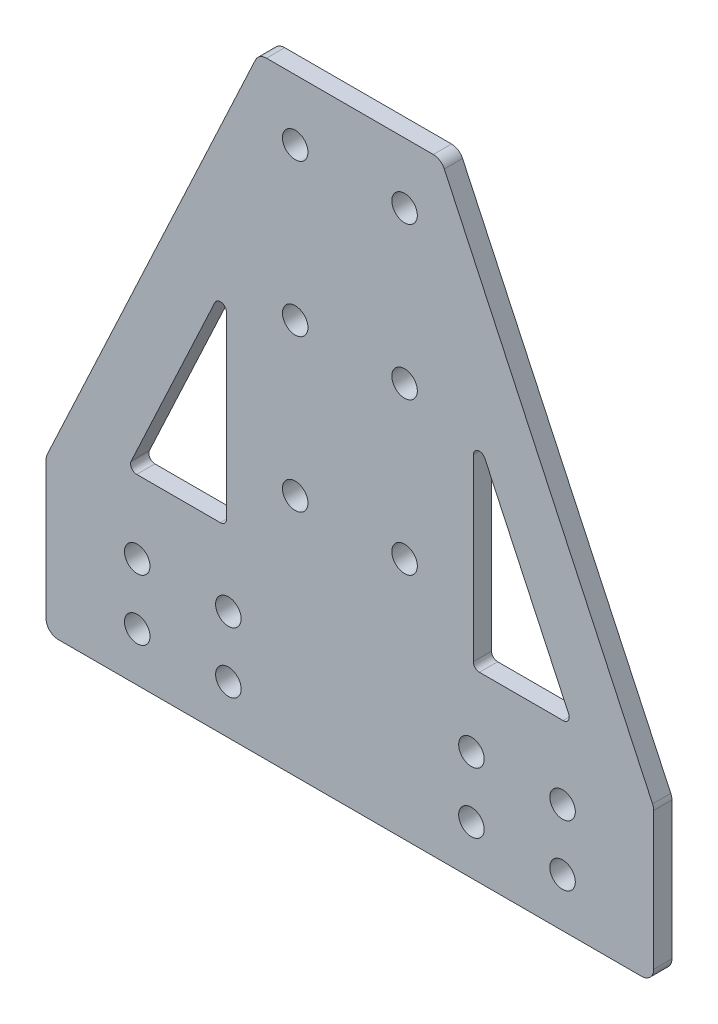
from build123d import *

# Parameters (mm, degrees)
EXTRUDE_1_DEPTH     = 3
CUT_EXTRUDE_2_REACH = 76.221
SKETCH_2_R          = 2.1
FILLET_1_R          = 2


with BuildPart() as part:
    # 草图1 → 凸台-拉伸1 (new body)
    with BuildSketch(Plane.XY):
        Polygon((-15, 45.229945154), (15, 45.229945154), (50, -29.684017461), (50, -54.770054846), (-50, -54.770054846), (-50, -29.684017461), align=None)
    extrude(amount=EXTRUDE_1_DEPTH)

    # 草图2 → 切除-拉伸2 (cut, up to next)
    with BuildSketch(Plane.XY.offset(3), mode=Mode.PRIVATE) as cut_extrude_2_sk1:
        with Locations((-9, 35.229945154)):
            Circle(SKETCH_2_R)
    cut_extrude_2_tool1 = extrude(cut_extrude_2_sk1.sketch, amount=-CUT_EXTRUDE_2_REACH, mode=Mode.PRIVATE) & part.part
    # 草图2 → 切除-拉伸2 (cut, up to next)
    with BuildSketch(Plane.XY.offset(3), mode=Mode.PRIVATE) as cut_extrude_2_sk2:
        with Locations((9, 35.229945154)):
            Circle(SKETCH_2_R)
    cut_extrude_2_tool2 = extrude(cut_extrude_2_sk2.sketch, amount=-CUT_EXTRUDE_2_REACH, mode=Mode.PRIVATE) & part.part
    # 草图2 → 切除-拉伸2 (cut, up to next)
    with BuildSketch(Plane.XY.offset(3), mode=Mode.PRIVATE) as cut_extrude_2_sk3:
        with Locations((9, 10.229945154)):
            Circle(SKETCH_2_R)
    cut_extrude_2_tool3 = extrude(cut_extrude_2_sk3.sketch, amount=-CUT_EXTRUDE_2_REACH, mode=Mode.PRIVATE) & part.part
    # 草图2 → 切除-拉伸2 (cut, up to next)
    with BuildSketch(Plane.XY.offset(3), mode=Mode.PRIVATE) as cut_extrude_2_sk4:
        with Locations((-9, 10.229945154)):
            Circle(SKETCH_2_R)
    cut_extrude_2_tool4 = extrude(cut_extrude_2_sk4.sketch, amount=-CUT_EXTRUDE_2_REACH, mode=Mode.PRIVATE) & part.part
    # 草图2 → 切除-拉伸2 (cut, up to next)
    with BuildSketch(Plane.XY.offset(3), mode=Mode.PRIVATE) as cut_extrude_2_sk5:
        with Locations((-20, -36.770054846)):
            Circle(SKETCH_2_R)
    cut_extrude_2_tool5 = extrude(cut_extrude_2_sk5.sketch, amount=-CUT_EXTRUDE_2_REACH, mode=Mode.PRIVATE) & part.part
    # 草图2 → 切除-拉伸2 (cut, up to next)
    with BuildSketch(Plane.XY.offset(3), mode=Mode.PRIVATE) as cut_extrude_2_sk6:
        with Locations((-20, -46.770054846)):
            Circle(SKETCH_2_R)
    cut_extrude_2_tool6 = extrude(cut_extrude_2_sk6.sketch, amount=-CUT_EXTRUDE_2_REACH, mode=Mode.PRIVATE) & part.part
    # 草图2 → 切除-拉伸2 (cut, up to next)
    with BuildSketch(Plane.XY.offset(3), mode=Mode.PRIVATE) as cut_extrude_2_sk7:
        with Locations((20, -46.770054846)):
            Circle(SKETCH_2_R)
    cut_extrude_2_tool7 = extrude(cut_extrude_2_sk7.sketch, amount=-CUT_EXTRUDE_2_REACH, mode=Mode.PRIVATE) & part.part
    # 草图2 → 切除-拉伸2 (cut, up to next)
    with BuildSketch(Plane.XY.offset(3), mode=Mode.PRIVATE) as cut_extrude_2_sk8:
        with Locations((20, -36.770054846)):
            Circle(SKETCH_2_R)
    cut_extrude_2_tool8 = extrude(cut_extrude_2_sk8.sketch, amount=-CUT_EXTRUDE_2_REACH, mode=Mode.PRIVATE) & part.part
    # 草图2 → 切除-拉伸2 (cut, up to next)
    with BuildSketch(Plane.XY.offset(3), mode=Mode.PRIVATE) as cut_extrude_2_sk9:
        with Locations((-9, -14.770054846)):
            Circle(SKETCH_2_R)
    cut_extrude_2_tool9 = extrude(cut_extrude_2_sk9.sketch, amount=-CUT_EXTRUDE_2_REACH, mode=Mode.PRIVATE) & part.part
    # 草图2 → 切除-拉伸2 (cut, up to next)
    with BuildSketch(Plane.XY.offset(3), mode=Mode.PRIVATE) as cut_extrude_2_sk10:
        with Locations((9, -14.770054846)):
            Circle(SKETCH_2_R)
    cut_extrude_2_tool10 = extrude(cut_extrude_2_sk10.sketch, amount=-CUT_EXTRUDE_2_REACH, mode=Mode.PRIVATE) & part.part
    # 草图2 → 切除-拉伸2 (cut, up to next)
    with BuildSketch(Plane.XY.offset(3), mode=Mode.PRIVATE) as cut_extrude_2_sk11:
        with Locations((-35, -36.770054846)):
            Circle(SKETCH_2_R)
    cut_extrude_2_tool11 = extrude(cut_extrude_2_sk11.sketch, amount=-CUT_EXTRUDE_2_REACH, mode=Mode.PRIVATE) & part.part
    # 草图2 → 切除-拉伸2 (cut, up to next)
    with BuildSketch(Plane.XY.offset(3), mode=Mode.PRIVATE) as cut_extrude_2_sk12:
        with Locations((-35, -46.770054846)):
            Circle(SKETCH_2_R)
    cut_extrude_2_tool12 = extrude(cut_extrude_2_sk12.sketch, amount=-CUT_EXTRUDE_2_REACH, mode=Mode.PRIVATE) & part.part
    # 草图2 → 切除-拉伸2 (cut, up to next)
    with BuildSketch(Plane.XY.offset(3), mode=Mode.PRIVATE) as cut_extrude_2_sk13:
        with Locations((35, -36.770054846)):
            Circle(SKETCH_2_R)
    cut_extrude_2_tool13 = extrude(cut_extrude_2_sk13.sketch, amount=-CUT_EXTRUDE_2_REACH, mode=Mode.PRIVATE) & part.part
    # 草图2 → 切除-拉伸2 (cut, up to next)
    with BuildSketch(Plane.XY.offset(3), mode=Mode.PRIVATE) as cut_extrude_2_sk14:
        with Locations((35, -46.770054846)):
            Circle(SKETCH_2_R)
    cut_extrude_2_tool14 = extrude(cut_extrude_2_sk14.sketch, amount=-CUT_EXTRUDE_2_REACH, mode=Mode.PRIVATE) & part.part
    # 草图2 → 切除-拉伸2 (cut, up to next)
    with BuildSketch(Plane.XY.offset(3), mode=Mode.PRIVATE) as cut_extrude_2_sk15:
        with BuildLine():
            Line((-20.314527419, 5.727067103), (-20.314527419, -23.770054846))
            ThreePointArc((-20.314527419, -23.770054846), (-20.607420638, -24.477161627), (-21.314527419, -24.770054846))
            Line((-21.314527419, -24.770054846), (-35.09566023, -24.770054846))
            ThreePointArc((-35.09566023, -24.770054846), (-35.939249041, -24.307044527), (-36.001657204, -23.346770682))
            Line((-36.001657204, -23.346770682), (-22.220524392, 6.150351268))
            ThreePointArc((-22.220524392, 6.150351268), (-21.097729095, 6.703283517), (-20.314527419, 5.727067103))
        make_face()
    cut_extrude_2_tool15 = extrude(cut_extrude_2_sk15.sketch, amount=-CUT_EXTRUDE_2_REACH, mode=Mode.PRIVATE) & part.part
    # 草图2 → 切除-拉伸2 (cut, up to next)
    with BuildSketch(Plane.XY.offset(3), mode=Mode.PRIVATE) as cut_extrude_2_sk16:
        with BuildLine():
            Line((36.001657204, -23.346770682), (22.220524392, 6.150351268))
            ThreePointArc((22.220524392, 6.150351268), (21.097729095, 6.703283517), (20.314527419, 5.727067103))
            Line((20.314527419, 5.727067103), (20.314527419, -23.770054846))
            ThreePointArc((20.314527419, -23.770054846), (20.607420638, -24.477161627), (21.314527419, -24.770054846))
            Line((21.314527419, -24.770054846), (35.09566023, -24.770054846))
            ThreePointArc((35.09566023, -24.770054846), (35.939249041, -24.307044527), (36.001657204, -23.346770682))
        make_face()
    cut_extrude_2_tool16 = extrude(cut_extrude_2_sk16.sketch, amount=-CUT_EXTRUDE_2_REACH, mode=Mode.PRIVATE) & part.part
    add(cut_extrude_2_tool1.solids().sort_by_distance((-9, 35.229945, 3))[0], mode=Mode.SUBTRACT)
    add(cut_extrude_2_tool2.solids().sort_by_distance((9, 35.229945, 3))[0], mode=Mode.SUBTRACT)
    add(cut_extrude_2_tool3.solids().sort_by_distance((9, 10.229945, 3))[0], mode=Mode.SUBTRACT)
    add(cut_extrude_2_tool4.solids().sort_by_distance((-9, 10.229945, 3))[0], mode=Mode.SUBTRACT)
    add(cut_extrude_2_tool5.solids().sort_by_distance((-20, -36.770055, 3))[0], mode=Mode.SUBTRACT)
    add(cut_extrude_2_tool6.solids().sort_by_distance((-20, -46.770055, 3))[0], mode=Mode.SUBTRACT)
    add(cut_extrude_2_tool7.solids().sort_by_distance((20, -46.770055, 3))[0], mode=Mode.SUBTRACT)
    add(cut_extrude_2_tool8.solids().sort_by_distance((20, -36.770055, 3))[0], mode=Mode.SUBTRACT)
    add(cut_extrude_2_tool9.solids().sort_by_distance((-9, -14.770055, 3))[0], mode=Mode.SUBTRACT)
    add(cut_extrude_2_tool10.solids().sort_by_distance((9, -14.770055, 3))[0], mode=Mode.SUBTRACT)
    add(cut_extrude_2_tool11.solids().sort_by_distance((-35, -36.770055, 3))[0], mode=Mode.SUBTRACT)
    add(cut_extrude_2_tool12.solids().sort_by_distance((-35, -46.770055, 3))[0], mode=Mode.SUBTRACT)
    add(cut_extrude_2_tool13.solids().sort_by_distance((35, -36.770055, 3))[0], mode=Mode.SUBTRACT)
    add(cut_extrude_2_tool14.solids().sort_by_distance((35, -46.770055, 3))[0], mode=Mode.SUBTRACT)
    add(cut_extrude_2_tool15.solids().sort_by_distance((-25.803132, -13.304968, 3))[0], mode=Mode.SUBTRACT)
    add(cut_extrude_2_tool16.solids().sort_by_distance((25.803132, -13.304968, 3))[0], mode=Mode.SUBTRACT)

    # 圆角1
    fillet_1_edges = [part.edges().sort_by_distance(p)[0] for p in [
        (-15, 45.229945154, 1.5),
        (-50, -29.684017461, 1.5),
        (-50, -54.770054846, 1.5),
        (50, -54.770054846, 1.5),
        (50, -29.684017461, 1.5),
        (15, 45.229945154, 1.5),
    ]]
    fillet(fillet_1_edges, radius=FILLET_1_R)


solid = part.part
